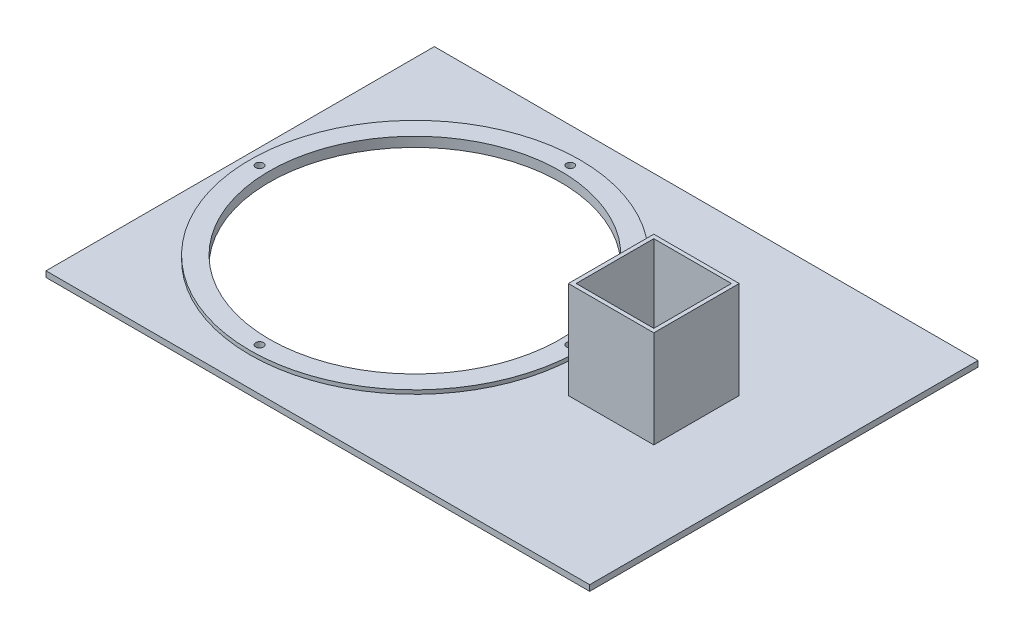
from build123d import *

# Parameters (mm, degrees)
SKETCH_1_W          = 280
SKETCH_1_H          = 200
SKETCH_1_R          = 85
EXTRUDE_1_DEPTH     = 3
SKETCH_1_4_R        = 85
SKETCH_1_4_R_2      = 2
SKETCH_1_4_R_3      = 75
EXTRUDE_3_DEPTH     = 5
SKETCH_2_W          = 44
SKETCH_2_H          = 44
SKETCH_2_W_2        = 40
SKETCH_2_H_2        = 40
EXTRUDE_4_DEPTH     = 50
SKETCH_3_R          = 1
CUT_EXTRUDE_1_DEPTH = 50


with BuildPart() as part:
    # 草图1 → 凸台-拉伸1 (new body)
    with BuildSketch(Plane(origin=(0, 0, 0), x_dir=(1, 0, 0), z_dir=(0, 1, 0))):
        Rectangle(SKETCH_1_W, SKETCH_1_H)
        with Locations((-50, 0)):
            Circle(SKETCH_1_R, mode=Mode.SUBTRACT)
    extrude(amount=EXTRUDE_1_DEPTH)

    # 草图1<4> → 凸台-拉伸3 (add)
    with BuildSketch(Plane(origin=(0, 0, 0), x_dir=(1, 0, 0), z_dir=(0, 1, 0))):
        with Locations((-50, 0)):
            Circle(SKETCH_1_4_R)
        with Locations((-50, -80)):
            Circle(SKETCH_1_4_R_2, mode=Mode.SUBTRACT)
        with Locations((-130, 0)):
            Circle(SKETCH_1_4_R_2, mode=Mode.SUBTRACT)
        with Locations((-50, 0)):
            Circle(SKETCH_1_4_R_3, mode=Mode.SUBTRACT)
        with Locations((-50, 80)):
            Circle(SKETCH_1_4_R_2, mode=Mode.SUBTRACT)
        with Locations((30, 0)):
            Circle(SKETCH_1_4_R_2, mode=Mode.SUBTRACT)
    extrude(amount=EXTRUDE_3_DEPTH)

    # 草图2 → 凸台-拉伸4 (add)
    with BuildSketch(Plane(origin=(0, 3, 0), x_dir=(1, 0, 0), z_dir=(0, 1, 0))):
        with Locations((72.175056864, 0.848639526)):
            Rectangle(SKETCH_2_W, SKETCH_2_H)
        with Locations((72.175056864, 0.848639526)):
            Rectangle(SKETCH_2_W_2, SKETCH_2_H_2, mode=Mode.SUBTRACT)
    extrude(amount=EXTRUDE_4_DEPTH)

    # 草图3 → 切除-拉伸1 (cut)
    with BuildSketch(Plane(origin=(0, 3, 0), x_dir=(1, 0, 0), z_dir=(0, 1, 0))):
        with Locations((72.175056864, 0.848639526)):
            Circle(SKETCH_3_R)
    extrude(amount=-CUT_EXTRUDE_1_DEPTH, mode=Mode.SUBTRACT)


solid = part.part
